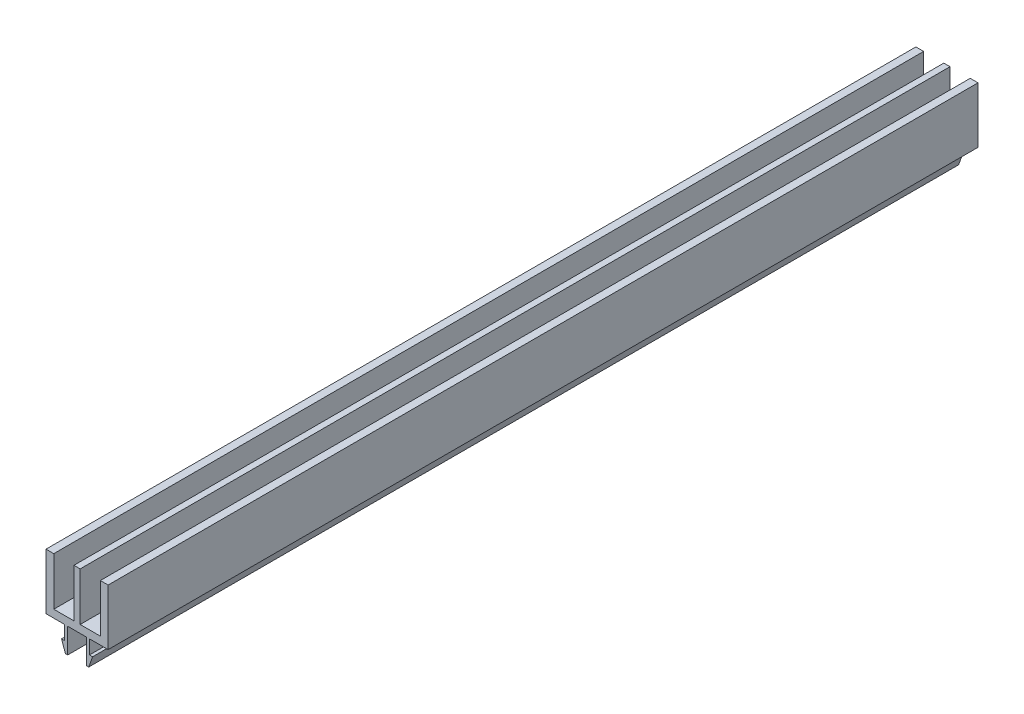
from build123d import *

# Parameters (mm, degrees)
BOSS_EXTRU_1_DEPTH = 280


with BuildPart() as part:
    # Esquisse1 → Boss.-Extru.1 (new body)
    with BuildSketch(Plane.XY.offset(50)):
        Polygon((-1, 2.5), (-7.5, 2.5), (-7.5, 17.999999998), (-10, 17.999999998), (-10, 0), (-4, 0), (-4, -4.5), (-5, -4.5), (-3.75, -8), (-3, -8), (-3, 0), (3, 0), (3, -8), (3.75, -8), (5, -4.5), (4, -4.5), (4, 0), (10, 0), (10, 17.999999998), (7.5, 17.999999998), (7.5, 2.5), (1, 2.5), (1, 17.999999998), (-1, 17.999999998), align=None)
    extrude(amount=-BOSS_EXTRU_1_DEPTH)


solid = part.part
